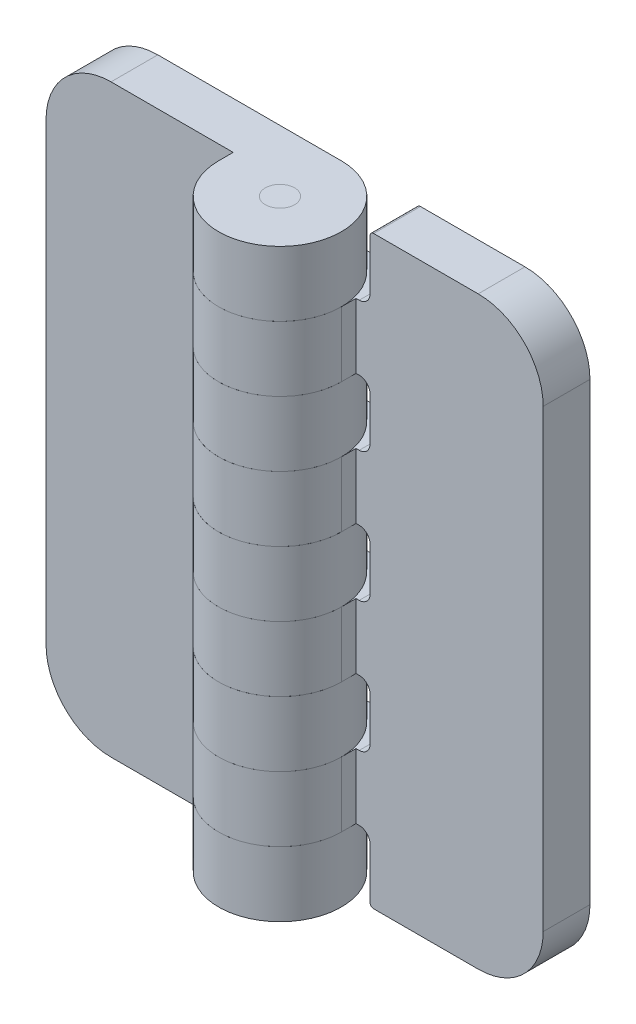
from build123d import *

# Parameters (mm, degrees)
BOSS_EXTRUDE1_START = 31.75
SKETCH3_R           = 1.5875
BOSS_EXTRUDE1_DEPTH = 63.5
FILLET1_R           = 7.055555556
SKETCH5_W           = 16.383
SKETCH5_H           = 7.055555556
CUT_EXTRUDE1_DEPTH  = 43.200038063
LPATTERN1_COUNT     = 5
LPATTERN1_PITCH     = 14.111111111
FILLET2_R           = 1.175925926
SKETCH6_W           = 16.383
SKETCH6_H           = 7.055555555
CUT_EXTRUDE2_DEPTH  = 43.200038063
LPATTERN2_COUNT     = 4
LPATTERN2_PITCH     = 14.111111111
FILLET3_R           = 1.175925926
FILLET4_R           = 0.391975309
BOSS_EXTRUDE3_START = 31.75
SKETCH7_R           = 1.5875
BOSS_EXTRUDE3_DEPTH = 63.5


with BuildPart() as part:
    # Sketch3 → Boss-Extrude1 (new body)
    with BuildSketch(Plane(origin=(0, 0, 0), x_dir=(1, 0, 0), z_dir=(0, 1, 0)).offset(BOSS_EXTRUDE1_START)):
        with BuildLine():
            Line((26.9875, 6.6675), (26.9875, 1.5875))
            Line((26.9875, 1.5875), (6.6675, 1.5875))
            Line((6.6675, 1.5875), (6.6675, 0))
            ThreePointArc((6.6675, 0), (-4.714634464, -4.714634464), (0, 6.6675))
            Line((0, 6.6675), (26.9875, 6.6675))
        make_face()
        with Locations(Location((0, 0, 0), (0, 0, 270))):
            Circle(SKETCH3_R, mode=Mode.SUBTRACT)
    extrude(amount=-BOSS_EXTRUDE1_DEPTH)

    # Fillet1
    fillet1_edges = [part.edges().sort_by_distance(p)[0] for p in [
        (26.9875, -31.75, -4.1275),
        (26.9875, 31.75, -4.1275),
    ]]
    fillet(fillet1_edges, radius=FILLET1_R)


with BuildPart() as body_2:
    # Mirror1: mirrored copy
    add(part.part.mirror(Plane(origin=(0, 0, 0), x_dir=(0, 0, 1), z_dir=(1, 0, 0))))

    # Sketch6 → Cut-Extrude2 (cut, symmetric)
    with BuildSketch(Plane.XY):
        with Locations((0, 21.166666666)):
            Rectangle(SKETCH6_W, SKETCH6_H)
    cut_extrude2 = extrude(amount=CUT_EXTRUDE2_DEPTH, both=True, mode=Mode.SUBTRACT)

    # LPattern2: Cut-Extrude2 ×4
    with Locations(*[(0, -i * LPATTERN2_PITCH, 0) for i in range(1, LPATTERN2_COUNT)]):
        add(cut_extrude2, mode=Mode.SUBTRACT)

    # Fillet3
    fillet3_edges = [body_2.edges().sort_by_distance(p)[0] for p in [
        (-8.1915, -3.527777778, -4.1275),
        (-8.1915, -10.583333333, -4.1275),
        (-8.1915, -17.638888889, -4.1275),
        (-8.1915, -24.694444444, -4.1275),
        (-8.1915, 24.694444444, -4.1275),
        (-8.1915, 17.638888889, -4.1275),
        (-8.1915, 10.583333333, -4.1275),
        (-8.1915, 3.527777778, -4.1275),
    ]]
    fillet(fillet3_edges, radius=FILLET3_R)


with BuildPart() as part_1:
    add(part.part)

    # Sketch5 → Cut-Extrude1 (cut, symmetric)
    with BuildSketch(Plane.XY):
        with Locations((0, 28.222222222)):
            Rectangle(SKETCH5_W, SKETCH5_H)
    cut_extrude1 = extrude(amount=CUT_EXTRUDE1_DEPTH, both=True, mode=Mode.SUBTRACT)

    # LPattern1: Cut-Extrude1 ×5
    with Locations(*[(0, -i * LPATTERN1_PITCH, 0) for i in range(1, LPATTERN1_COUNT)]):
        add(cut_extrude1, mode=Mode.SUBTRACT)

    # Fillet2
    fillet2_edges = [part_1.edges().sort_by_distance(p)[0] for p in [
        (8.1915, -3.527777778, -4.1275),
        (8.1915, 3.527777778, -4.1275),
        (8.1915, -17.638888889, -4.1275),
        (8.1915, -10.583333333, -4.1275),
        (8.1915, -24.694444444, -4.1275),
        (8.1915, 24.694444444, -4.1275),
        (8.1915, 10.583333333, -4.1275),
        (8.1915, 17.638888889, -4.1275),
    ]]
    fillet(fillet2_edges, radius=FILLET2_R)

    # Fillet4
    fillet4_edges = [part_1.edges().sort_by_distance(p)[0] for p in [
        (8.1915, -31.75, -4.1275),
        (8.1915, 31.75, -4.1275),
    ]]
    fillet(fillet4_edges, radius=FILLET4_R)


with BuildPart() as body_3:
    # Sketch7 → Boss-Extrude3 (new body)
    with BuildSketch(Plane(origin=(0, 0, 0), x_dir=(1, 0, 0), z_dir=(0, 1, 0)).offset(BOSS_EXTRUDE3_START)):
        with Locations(Location((0, 0, 0), (0, 0, 270))):
            Circle(SKETCH7_R)
    extrude(amount=-BOSS_EXTRUDE3_DEPTH)


solid = Compound([body_2.part, part_1.part, body_3.part])
